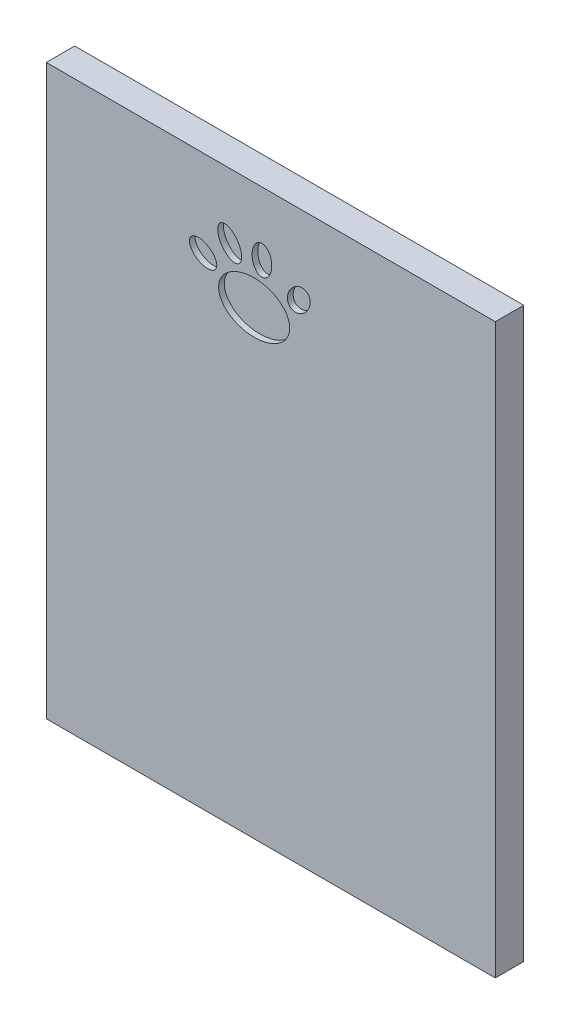
from build123d import *

# Parameters (mm, degrees)
SKETCH_1_W          = 158
SKETCH_1_H          = 200
EXTRUDE_1_DEPTH     = 10
SKETCH_2_RX         = 12.510915337
SKETCH_2_RY         = 9.050449393
SKETCH_2_RX_2       = 5.182590636
SKETCH_2_RY_2       = 3.452265776
SKETCH_2_RX_3       = 5.641827611
SKETCH_2_RX_4       = 5.141705424
SKETCH_2_RX_5       = 4.748897539
CUT_EXTRUDE_1_DEPTH = 2


with BuildPart() as part:
    # 草圖1 → 填料-伸長1 (new body)
    with BuildSketch(Plane.XY):
        with Locations((79, 100)):
            Rectangle(SKETCH_1_W, SKETCH_1_H)
    extrude(amount=EXTRUDE_1_DEPTH)

    # 草圖2 → 除料-伸長1 (cut)
    with BuildSketch(Plane.XY.offset(10)):
        with Locations((73.143826864, 161.889102465)):
            Ellipse(SKETCH_2_RX, SKETCH_2_RY)
        with Locations(Location((55.175550619, 169.508366321), (0, 0, -29.658527045))):
            Ellipse(SKETCH_2_RX_2, SKETCH_2_RY_2)
        with Locations(Location((64.548995649, 177.167911946), (0, 0, -57.180664348))):
            Ellipse(SKETCH_2_RX_3, SKETCH_2_RY_2)
        with Locations(Location((75.880101936, 177.650055904), (0, 0, 90))):
            Ellipse(SKETCH_2_RX_4, SKETCH_2_RY_2)
        with Locations(Location((88.871515974, 172.008159222), (0, 0, -128.304052106))):
            Ellipse(SKETCH_2_RX_5, SKETCH_2_RY_2)
    extrude(amount=-CUT_EXTRUDE_1_DEPTH, mode=Mode.SUBTRACT)


solid = part.part
